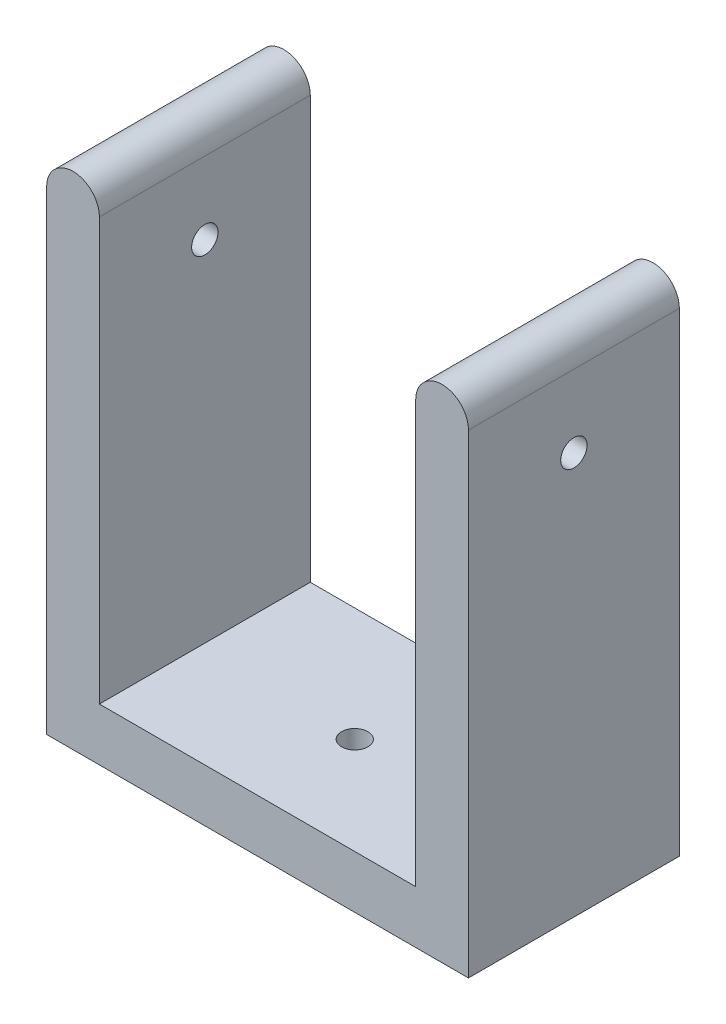
from build123d import *

# Parameters (mm, degrees)
BOSS_EXTRUDE3_DEPTH = 20
SKETCH3_R           = 1.25
CUT_EXTRUDE1_DEPTH  = 66.239941753
SKETCH5_R           = 1.25
CUT_EXTRUDE2_DEPTH  = 56.283360969


with BuildPart() as part:
    # Sketch2 → Boss-Extrude3 (new body)
    with BuildSketch(Plane.XY):
        with BuildLine():
            Line((-20, 0), (20, 0))
            Line((20, 0), (20, 45))
            ThreePointArc((20, 45), (17.5, 47.5), (15, 45))
            Line((15, 45), (15, 5))
            Line((15, 5), (-15, 5))
            Line((-15, 5), (-15, 45))
            ThreePointArc((-15, 45), (-17.5, 47.5), (-20, 45))
            Line((-20, 45), (-20, 0))
        make_face()
    extrude(amount=BOSS_EXTRUDE3_DEPTH)

    # Sketch3 → Cut-Extrude1 (cut, through all)
    with BuildSketch(Plane.ZY.offset(20)):
        with Locations(Location((10, 38.137651085, 0), (0, 0, 270))):
            Circle(SKETCH3_R)
    extrude(amount=-CUT_EXTRUDE1_DEPTH, mode=Mode.SUBTRACT)

    # Sketch5 → Cut-Extrude2 (cut, through all)
    with BuildSketch(Plane.XZ):
        with Locations((0, 10.783115236)):
            Circle(SKETCH5_R)
    extrude(amount=-CUT_EXTRUDE2_DEPTH, mode=Mode.SUBTRACT)


solid = part.part
